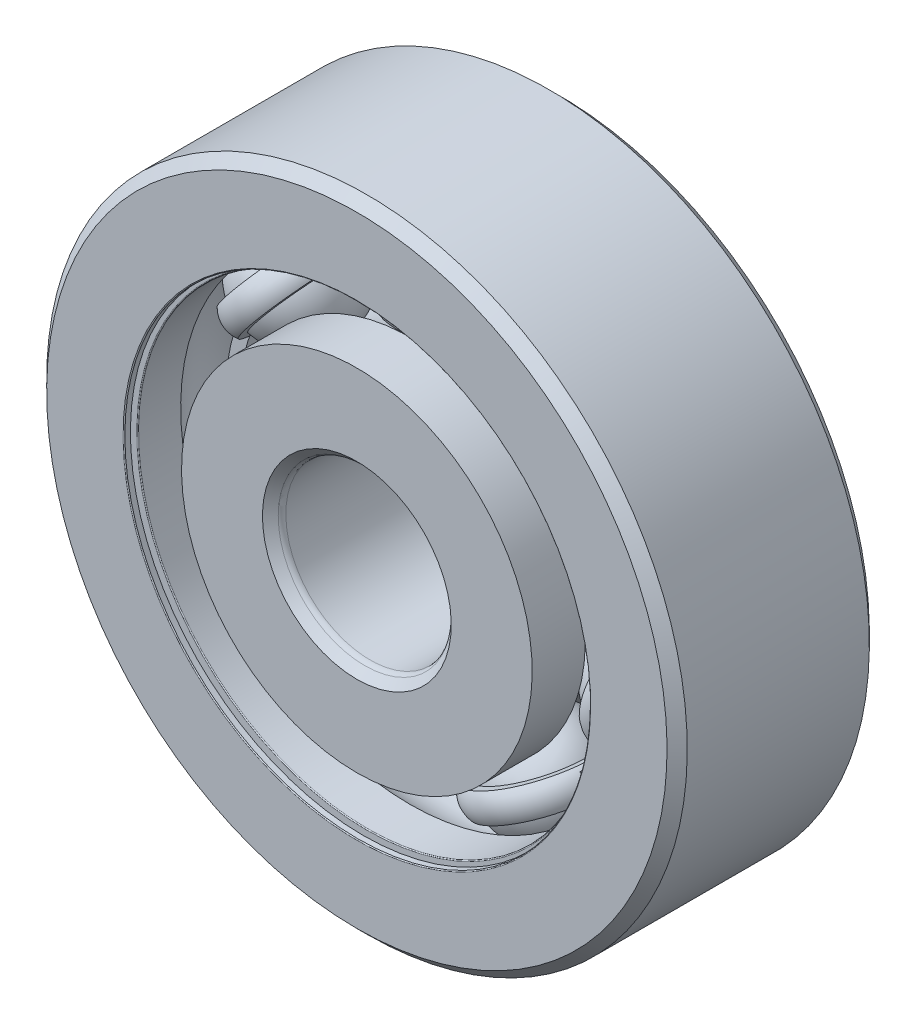
from build123d import *

# Parameters (mm, degrees)
BOSS_EXTRUDE1_DEPTH = 0.5
CIRPATTERN1_COUNT   = 7
CIRPATTERN2_COUNT   = 7
FILLET1_R           = 0.027
FILLET2_R           = 0.225


with BuildPart() as part:
    # Sketch3 → Revolve1 (revolve)
    with BuildSketch(Plane(origin=(0, 0, 0), x_dir=(0, 0, -1), z_dir=(1, 0, 0))):
        with BuildLine():
            Line((2.7, 9.5), (3, 9.2))
            Line((3, 9.2), (3, 6.8))
            Line((3, 6.8), (1.425, 6.8))
            ThreePointArc((1.425, 6.8), (0, 7.6342047), (-1.425, 6.8))
            Line((-1.425, 6.8), (-3, 6.8))
            Line((-3, 6.8), (-3, 9.2))
            Line((-3, 9.2), (-2.7, 9.5))
            Line((-2.7, 9.5), (2.7, 9.5))
        make_face()
    revolve(axis=Axis((0, 0, 3), (0, 0, -1)))

    # Sketch8 → Cut-Revolve1 (revolve, cut)
    with BuildSketch(Plane(origin=(0, 0, 0), x_dir=(0, 0, -1), z_dir=(1, 0, 0))):
        Polygon((-2.808, 6.8), (-2.7, 6.8), (-2.7, 7.7), (-2.808, 7.7), (-2.808, 6.908), (-3, 6.908), (-3, 6.8), align=None)
        Polygon((2.7, 6.8), (2.808, 6.8), (3, 6.8), (3, 6.908), (2.808, 6.908), (2.808, 7.7), (2.7, 7.7), align=None)
    revolve(axis=Axis((0, 0, 3), (0, 0, -1)), mode=Mode.SUBTRACT)

    # Fillet1
    fillet1_edges = [part.edges().sort_by_distance(p)[0] for p in [
        (0, -6.8, -2.7),
        (0, -6.908, -3),
        (0, -6.8, 2.7),
        (0, -6.908, 3),
    ]]
    fillet(fillet1_edges, radius=FILLET1_R)


with BuildPart() as body_2:
    # Sketch4 → Revolve2 (revolve)
    with BuildSketch(Plane(origin=(0, 0, 0), x_dir=(0, 0, -1), z_dir=(1, 0, 0))):
        with BuildLine():
            Line((-2.7, 2.5), (-3, 2.8))
            Line((-3, 2.8), (-3, 5.2))
            Line((-3, 5.2), (-1.425, 5.2))
            ThreePointArc((-1.425, 5.2), (0, 4.3657953), (1.425, 5.2))
            Line((1.425, 5.2), (3, 5.2))
            Line((3, 5.2), (3, 2.8))
            Line((3, 2.8), (2.7, 2.5))
            Line((2.7, 2.5), (-2.7, 2.5))
        make_face()
    revolve(axis=Axis((0, 0, 3), (0, 0, -1)))

    # Fillet2
    fillet2_edges = [body_2.edges().sort_by_distance(p)[0] for p in [
        (0, -2.5, -2.7),
        (0, -2.5, 2.7),
    ]]
    fillet(fillet2_edges, radius=FILLET2_R)


with BuildPart() as body_3:
    # Sketch5 → Revolve3 (revolve)
    with BuildSketch(Plane(origin=(0, 0, 0), x_dir=(0, 0, -1), z_dir=(1, 0, 0))):
        with BuildLine():
            Line((-1.6342047, 6), (1.6342047, 6))
            ThreePointArc((1.6342047, 6), (0, 7.6342047), (-1.6342047, 6))
        make_face()
    revolve(axis=Axis((0, 6, 1.6342047), (0, 0, -1)))


with BuildPart() as body_4:
    # Sketch6 → Revolve4 (revolve)
    with BuildSketch(Plane(origin=(0, 0, 0), x_dir=(0, 0, -1), z_dir=(1, 0, 0))):
        with BuildLine():
            Line((-1.584495188, 6.4), (-1.820412656, 6.4))
            ThreePointArc((-1.820412656, 6.4), (-1.938371391, 6), (-1.820412656, 5.6))
            Line((-1.820412656, 5.6), (-1.584495188, 5.6))
            ThreePointArc((-1.584495188, 5.6), (-1.6342047, 6), (-1.584495188, 6.4))
        make_face()
    revolve4 = revolve(axis=Axis((0, 9.5, 0), (0, -1, 0)))

    # Sketch7 → Boss-Extrude1 (add, symmetric)
    with BuildSketch(Plane.XY):
        with BuildLine():
            Line((4.690988895, 3.740938811), (5.003721488, 3.990334732))
            ThreePointArc((5.003721488, 3.990334732), (2.77685593, 5.766200755), (0, 6.4))
            Line((0, 6.4), (0, 6))
            ThreePointArc((0, 6), (2.603302435, 5.405813207), (4.690988895, 3.740938811))
        make_face()
    boss_extrude1 = extrude(amount=BOSS_EXTRUDE1_DEPTH, both=True)

    # CirPattern2: Revolve4, Boss-Extrude1 ×7 about axis
    cirpattern2_axis = Axis((0, 0, 3), (0, 0, -1))
    add([revolve4.rotate(cirpattern2_axis, i * 360 / CIRPATTERN2_COUNT) for i in range(1, CIRPATTERN2_COUNT)])
    add([boss_extrude1.rotate(cirpattern2_axis, i * 360 / CIRPATTERN2_COUNT) for i in range(1, CIRPATTERN2_COUNT)])


with BuildPart() as cirpattern1_1:
    # CirPattern1: pattern copy
    add(body_3.part.rotate(Axis((0, 0, 3), (0, 0, -1)), 1 * 360 / CIRPATTERN1_COUNT))


with BuildPart() as cirpattern1_2:
    # CirPattern1: pattern copy
    add(body_3.part.rotate(Axis((0, 0, 3), (0, 0, -1)), 2 * 360 / CIRPATTERN1_COUNT))


with BuildPart() as cirpattern1_3:
    # CirPattern1: pattern copy
    add(body_3.part.rotate(Axis((0, 0, 3), (0, 0, -1)), 3 * 360 / CIRPATTERN1_COUNT))


with BuildPart() as cirpattern1_4:
    # CirPattern1: pattern copy
    add(body_3.part.rotate(Axis((0, 0, 3), (0, 0, -1)), 4 * 360 / CIRPATTERN1_COUNT))


with BuildPart() as cirpattern1_5:
    # CirPattern1: pattern copy
    add(body_3.part.rotate(Axis((0, 0, 3), (0, 0, -1)), 5 * 360 / CIRPATTERN1_COUNT))


with BuildPart() as cirpattern1_6:
    # CirPattern1: pattern copy
    add(body_3.part.rotate(Axis((0, 0, 3), (0, 0, -1)), 6 * 360 / CIRPATTERN1_COUNT))


solid = Compound([part.part, body_2.part, body_3.part, body_4.part, cirpattern1_1.part, cirpattern1_2.part, cirpattern1_3.part, cirpattern1_4.part, cirpattern1_5.part, cirpattern1_6.part])
